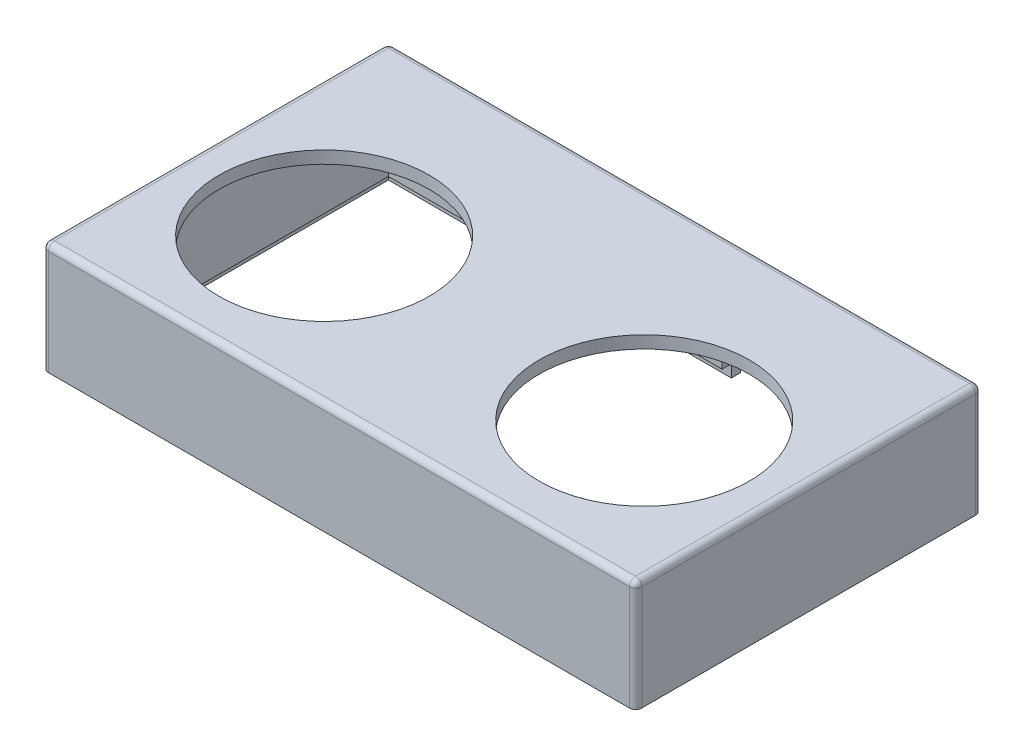
from build123d import *

# Parameters (mm, degrees)
SKETCH1_W           = 48
SKETCH1_H           = 28
BOSS_EXTRUDE1_DEPTH = 9
SKETCH2_W           = 45
SKETCH2_H           = 25
CUT_EXTRUDE1_DEPTH  = 8
SKETCH3_R           = 8.5
CUT_EXTRUDE2_DEPTH  = 22
SKETCH4_W           = 46.5
SKETCH4_H           = 26.5
CUT_EXTRUDE3_DEPTH  = 1
SKETCH10_W          = 8
SKETCH10_H          = 3.5
CUT_EXTRUDE4_DEPTH  = 30.206163733
FILLET5_R           = 0.5


with BuildPart() as part:
    # Sketch1 → Boss-Extrude1 (new body)
    with BuildSketch(Plane(origin=(0, 0, 0), x_dir=(1, 0, 0), z_dir=(0, 1, 0))):
        Rectangle(SKETCH1_W, SKETCH1_H)
    extrude(amount=BOSS_EXTRUDE1_DEPTH)

    # Sketch2 → Cut-Extrude1 (cut)
    with BuildSketch(Plane.XZ):
        Rectangle(SKETCH2_W, SKETCH2_H)
    extrude(amount=-CUT_EXTRUDE1_DEPTH, mode=Mode.SUBTRACT)

    # Sketch3 → Cut-Extrude2 (cut)
    with BuildSketch(Plane(origin=(0, 9, 0), x_dir=(1, 0, 0), z_dir=(0, 1, 0))):
        with Locations(Location((-12.95, -2.25, 0), (0, 0, 270))):
            Circle(SKETCH3_R)
        with Locations(Location((12.95, -2.25, 0), (0, 0, 270))):
            Circle(SKETCH3_R)
    extrude(amount=-CUT_EXTRUDE2_DEPTH, mode=Mode.SUBTRACT)

    # Sketch4 → Cut-Extrude3 (cut)
    with BuildSketch(Plane.XZ):
        Rectangle(SKETCH4_W, SKETCH4_H)
    extrude(amount=-CUT_EXTRUDE3_DEPTH, mode=Mode.SUBTRACT)

    # Sketch10 → Cut-Extrude4 (cut, through all)
    with BuildSketch(Plane.XY):
        with Locations((8.5, 1.75)):
            Rectangle(SKETCH10_W, SKETCH10_H)
    extrude(amount=-CUT_EXTRUDE4_DEPTH, mode=Mode.SUBTRACT)

    # Fillet5
    fillet5_edges = [part.edges().sort_by_distance(p)[0] for p in [
        (-24, 9, 0),
        (0, 9, 14),
        (24, 9, 0),
        (0, 9, -14),
        (24, 4.5, 14),
        (-24, 4.5, 14),
        (-24, 4.5, -14),
        (24, 4.5, -14),
    ]]
    fillet(fillet5_edges, radius=FILLET5_R)


solid = part.part
